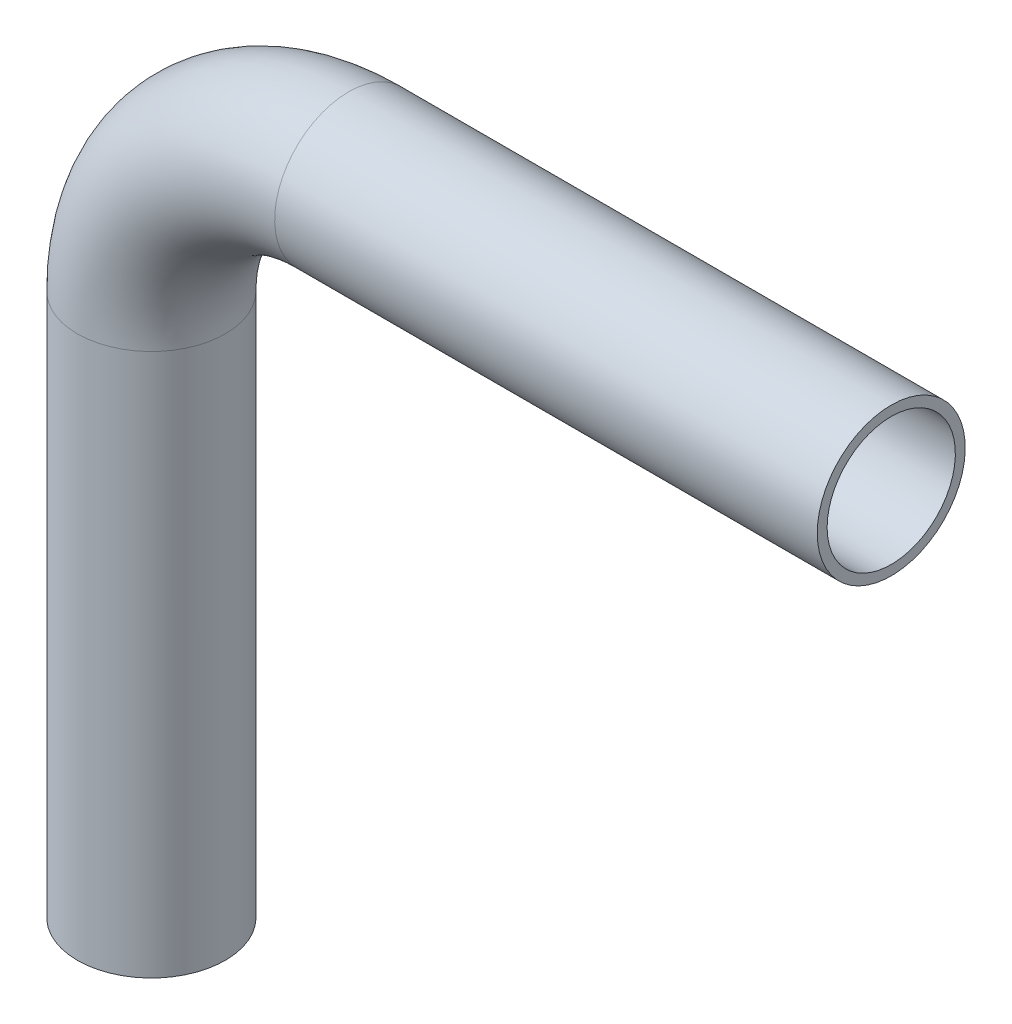
from build123d import *

# Parameters (mm, degrees)
ESBO_O2_R   = 15
ESBO_O2_R_2 = 13


with BuildPart() as part:
    # Varredura1: sweep along a path in Esboço1
    with BuildLine(Plane.XY) as varredura1_path:
        Line((0, 0), (0, 110))
        ThreePointArc((0, 110), (11.715728753, 138.284271247), (40, 150))
        Line((40, 150), (150, 150))
    # Esboço2 → Varredura1 (sweep)
    with BuildSketch(Plane(origin=(0, 0, 0), x_dir=(1, 0, 0), z_dir=(0, 1, 0))):
        Circle(ESBO_O2_R)
        Circle(ESBO_O2_R_2, mode=Mode.SUBTRACT)
    sweep(path=varredura1_path.line)


solid = part.part
